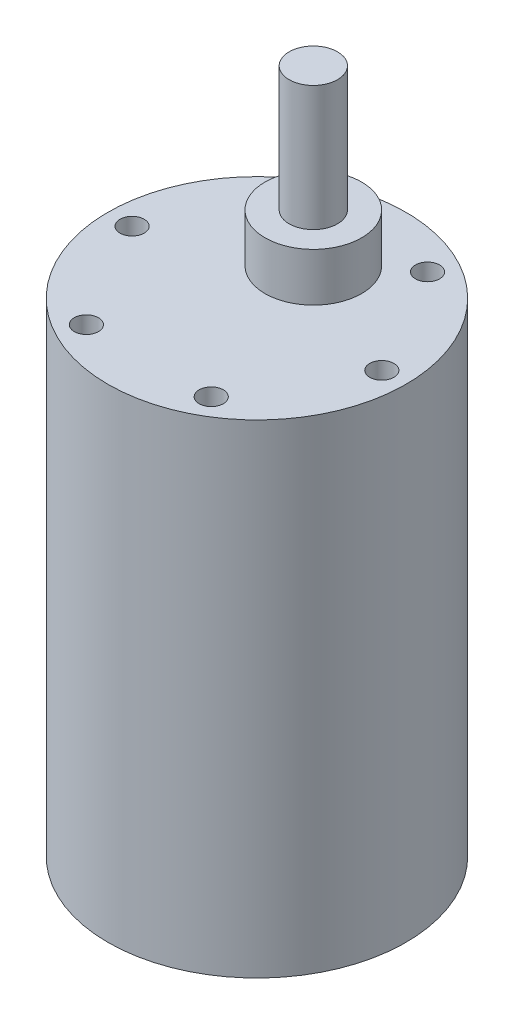
from build123d import *

# Parameters (mm, degrees)
SKETCH_1_R               = 18.5
EXTRUDE_1_DEPTH          = 60
SKETCH_2_R               = 6
EXTRUDE_2_DEPTH          = 6
SKETCH_4_R               = 3
EXTRUDE_3_DEPTH          = 15.5
SKETCH_3_R               = 1.5
CUT_EXTRUDE_1_DEPTH      = 5
PATTERN_CIRCULAR_2_COUNT = 6


with BuildPart() as part:
    # 草图1 → 凸台-拉伸1 (new body)
    with BuildSketch(Plane(origin=(0, 0, 0), x_dir=(1, 0, 0), z_dir=(0, 1, 0))):
        with Locations(Location((0, 0, 0), (0, 0, 270))):
            Circle(SKETCH_1_R)
    extrude(amount=EXTRUDE_1_DEPTH)

    # 草图2 → 凸台-拉伸2 (add)
    with BuildSketch(Plane(origin=(0, 60, 0), x_dir=(1, 0, 0), z_dir=(0, 1, 0))):
        with Locations(Location((0, 7, 0), (0, 0, 270))):
            Circle(SKETCH_2_R)
    extrude(amount=EXTRUDE_2_DEPTH)

    # 草图4 → 凸台-拉伸3 (add)
    with BuildSketch(Plane(origin=(0, 66, 0), x_dir=(1, 0, 0), z_dir=(0, 1, 0))):
        with Locations(Location((0, 7, 0), (0, 0, 270))):
            Circle(SKETCH_4_R)
    extrude(amount=EXTRUDE_3_DEPTH)

    # 草图3 → 切除-拉伸1 (cut)
    with BuildSketch(Plane(origin=(0, 60, 0), x_dir=(1, 0, 0), z_dir=(0, 1, 0))):
        with Locations(Location((-7.75, 13.423393759, 0), (0, 0, 270))):
            Circle(SKETCH_3_R)
    cut_extrude_1 = extrude(amount=-CUT_EXTRUDE_1_DEPTH, mode=Mode.SUBTRACT)

    # 阵列(圆周)2: 切除-拉伸1 ×6 about axis
    pattern_circular_2_axis = Axis((0, 0, 0), (0, 1, 0))
    for i in range(1, PATTERN_CIRCULAR_2_COUNT):
        add(cut_extrude_1.rotate(pattern_circular_2_axis, i * 360 / PATTERN_CIRCULAR_2_COUNT), mode=Mode.SUBTRACT)


solid = part.part
